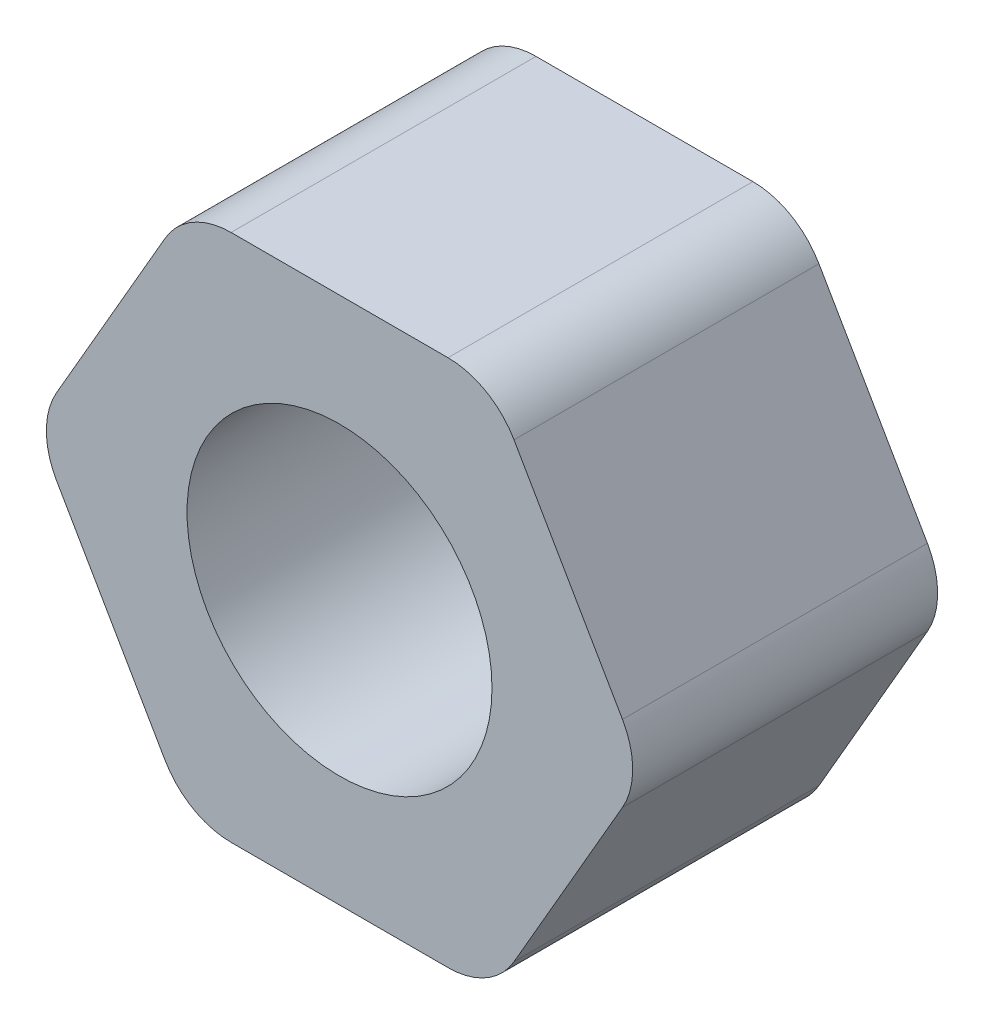
from build123d import *

# Parameters (mm, degrees)
SKETCH1_R           = 2
BOSS_EXTRUDE1_DEPTH = 4


with BuildPart() as part:
    # Sketch1 → Boss-Extrude1 (new body)
    with BuildSketch(Plane.XY):
        with BuildLine():
            Line((3.711324865, 0.5), (2.288675135, 2.964101615))
            ThreePointArc((2.288675135, 2.964101615), (1.922649731, 3.330127019), (1.422649731, 3.464101615))
            Line((1.422649731, 3.464101615), (-1.422649731, 3.464101615))
            ThreePointArc((-1.422649731, 3.464101615), (-1.922649731, 3.330127019), (-2.288675135, 2.964101615))
            Line((-2.288675135, 2.964101615), (-3.711324865, 0.5))
            ThreePointArc((-3.711324865, 0.5), (-3.845299462, 0), (-3.711324865, -0.5))
            Line((-3.711324865, -0.5), (-2.288675135, -2.964101615))
            ThreePointArc((-2.288675135, -2.964101615), (-1.922649731, -3.330127019), (-1.422649731, -3.464101615))
            Line((-1.422649731, -3.464101615), (1.422649731, -3.464101615))
            ThreePointArc((1.422649731, -3.464101615), (1.922649731, -3.330127019), (2.288675135, -2.964101615))
            Line((2.288675135, -2.964101615), (3.711324865, -0.5))
            ThreePointArc((3.711324865, -0.5), (3.845299462, 0), (3.711324865, 0.5))
        make_face()
        Circle(SKETCH1_R, mode=Mode.SUBTRACT)
    extrude(amount=BOSS_EXTRUDE1_DEPTH)


solid = part.part
